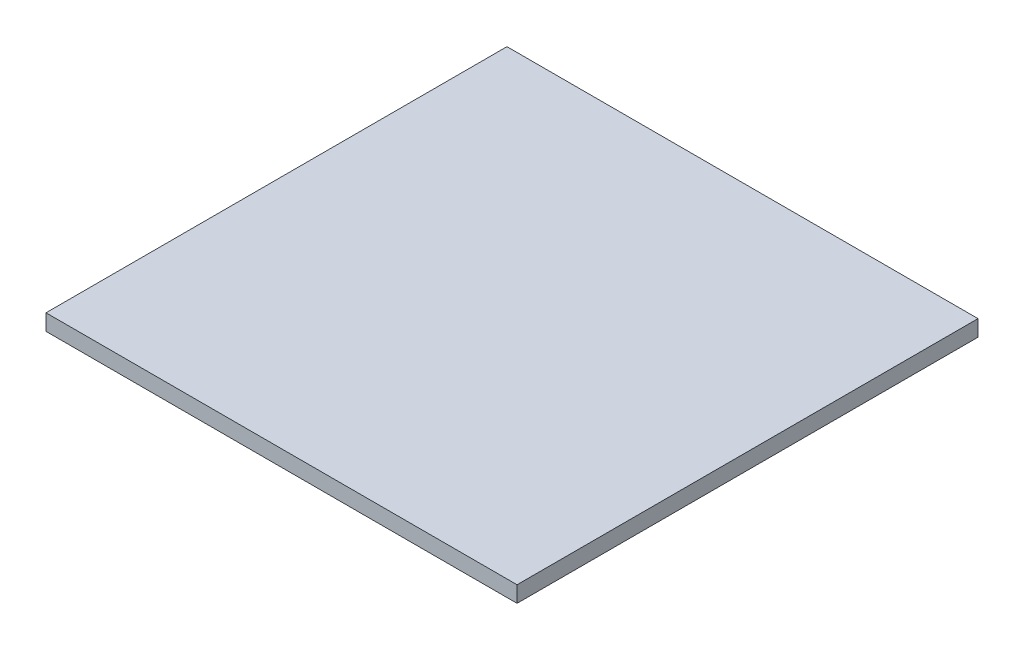
from build123d import *

# Parameters (mm, degrees)
SKETCH1_W           = 146.069209832
SKETCH1_H           = 142.939908802
BOSS_EXTRUDE1_DEPTH = 5


with BuildPart() as part:
    # Sketch1 → Boss-Extrude1 (new body)
    with BuildSketch(Plane.XZ.offset(12.6)):
        Rectangle(SKETCH1_W, SKETCH1_H)
    extrude(amount=BOSS_EXTRUDE1_DEPTH)


solid = part.part
